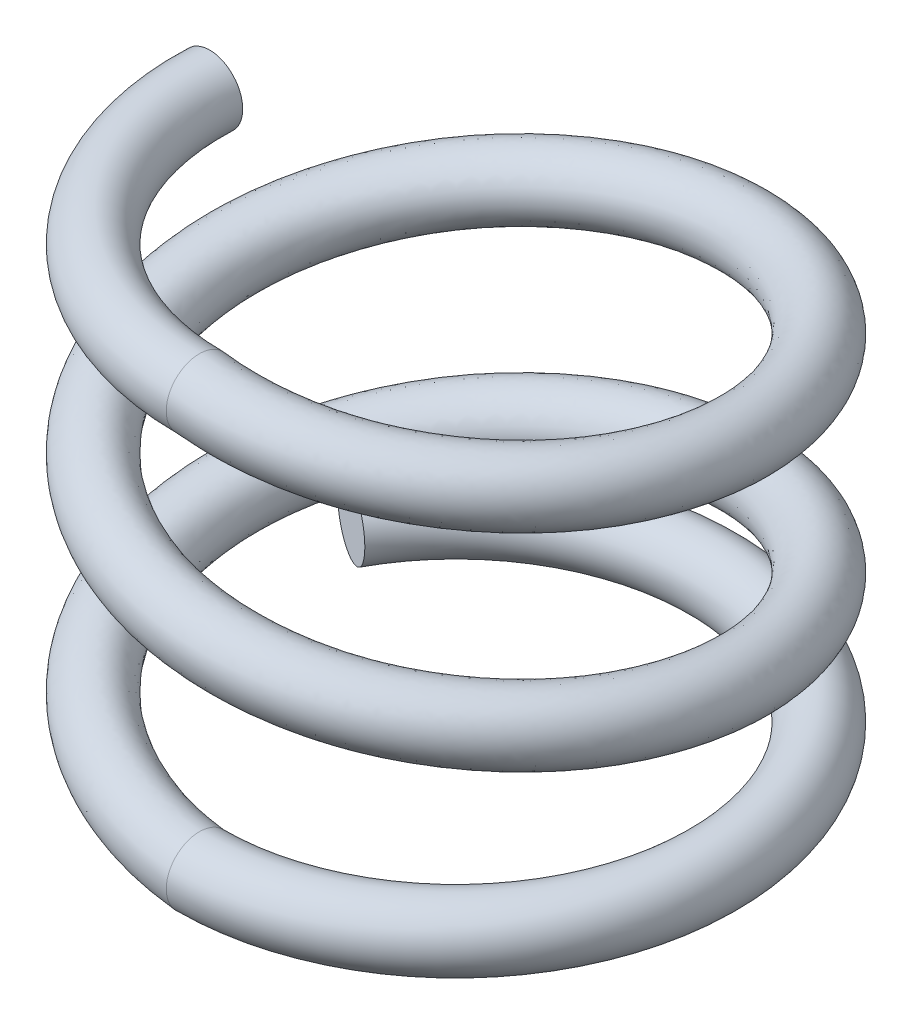
from build123d import *

# Parameters (mm, degrees)
SWEEP2_PITCH  = 2.5
SWEEP2_HEIGHT = 5
SWEEP2_RADIUS = 3.1
SKETCH3_R     = 0.4
SKETCH8_R     = 0.4
SKETCH10_R    = 0.4


with BuildPart() as part:
    # Sweep2: sweep along a helix
    with BuildLine() as sweep2_path:
        Helix(SWEEP2_PITCH, SWEEP2_HEIGHT, SWEEP2_RADIUS, center=(0, 0, 0), direction=(0, 1, 0), lefthand=True)
    # Sketch3 → Sweep2 (sweep)
    with BuildSketch(Plane(origin=(0, 0, 0), x_dir=(0, 0, -1), z_dir=(1, 0, 0))):
        with Locations((-3.1, 0)):
            Circle(SKETCH3_R)
    sweep(path=sweep2_path.line, is_frenet=True)

    # Sweep3: sweep along a path in Sketch7
    with BuildLine(Plane(origin=(0, 0, 0), x_dir=(1, 0, 0), z_dir=(0, 1, 0))) as sweep3_path:
        ThreePointArc((0, -3.1), (2.66036659, 1.591367213), (-2.731367849, 1.466161545))
    # Sketch8 → Sweep3 (sweep)
    with BuildSketch(Plane(origin=(0, 0, 0), x_dir=(0, 0, -1), z_dir=(1, 0, 0))):
        with Locations((-3.1, 0)):
            Circle(SKETCH8_R)
    sweep(path=sweep3_path.line)

    # Sweep4: sweep along a path in Sketch12
    with BuildLine(Plane(origin=(0, 5, 0), x_dir=(1, 0, 0), z_dir=(0, 1, 0))) as sweep4_path:
        ThreePointArc((0, -3.1), (-2.240571798, -2.142390725), (-3.096890476, 0.138814181))
    # Sketch10 → Sweep4 (sweep)
    with BuildSketch(Plane.ZY):
        with Locations((3.1, 5)):
            Circle(SKETCH10_R)
    sweep(path=sweep4_path.line)


solid = part.part
